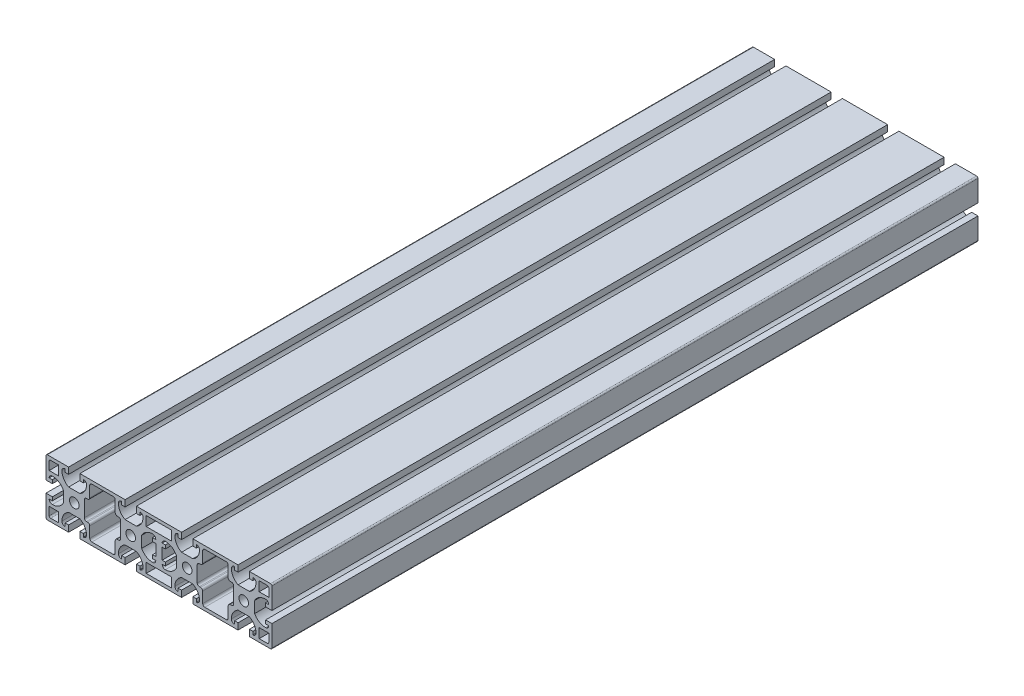
from build123d import *

# Parameters (mm, degrees)
SZKIC1_W                    = 18.057236458
SZKIC1_H                    = 6.778618229
SZKIC1_R                    = 3.4
DODANIE_WYCI_GNI_CIE1_DEPTH = 500


with BuildPart() as part:
    # Szkic1 → Dodanie-wyciągnięcie1 (new body)
    with BuildSketch(Plane.XY):
        with BuildLine():
            Line((-56, -20), (-24, -20))
            Line((-24, -20), (-24, -15.5))
            Line((-24, -15.5), (-26.471381771, -15.5))
            Line((-26.471381771, -15.5), (-26.471381771, -17.75))
            ThreePointArc((-26.471381771, -17.75), (-28.062372029, -17.090990258), (-28.721381771, -15.5))
            ThreePointArc((-28.721381771, -15.5), (-27.448087912, -10.962546258), (-24, -7.75))
            Line((-24, -7.75), (-16, -7.75))
            ThreePointArc((-16, -7.75), (-12.551912088, -10.962546258), (-11.278618229, -15.5))
            ThreePointArc((-11.278618229, -15.5), (-11.937627971, -17.090990258), (-13.528618229, -17.75))
            Line((-13.528618229, -17.75), (-13.528618229, -15.5))
            Line((-13.528618229, -15.5), (-16, -15.5))
            Line((-16, -15.5), (-16, -20))
            Line((-16, -20), (16, -20))
            Line((16, -20), (16, -15.5))
            Line((16, -15.5), (13.528618229, -15.5))
            Line((13.528618229, -15.5), (13.528618229, -17.75))
            ThreePointArc((13.528618229, -17.75), (11.937627971, -17.090990258), (11.278618229, -15.5))
            ThreePointArc((11.278618229, -15.5), (12.551912088, -10.962546258), (16, -7.75))
            Line((16, -7.75), (24, -7.75))
            ThreePointArc((24, -7.75), (27.448087912, -10.962546258), (28.721381771, -15.5))
            ThreePointArc((28.721381771, -15.5), (28.062372029, -17.090990258), (26.471381771, -17.75))
            Line((26.471381771, -17.75), (26.471381771, -15.5))
            Line((26.471381771, -15.5), (24, -15.5))
            Line((24, -15.5), (24, -20))
            Line((24, -20), (39, -20))
            ThreePointArc((39, -20), (39.707106781, -19.707106781), (40, -19))
            Line((40, -19), (40, -4))
            Line((40, -4), (35.5, -4))
            Line((35.5, -4), (35.5, -6.471381771))
            Line((35.5, -6.471381771), (37.75, -6.471381771))
            ThreePointArc((37.75, -6.471381771), (37.090990258, -8.062372029), (35.5, -8.721381771))
            ThreePointArc((35.5, -8.721381771), (30.962546258, -7.448087912), (27.75, -4))
            Line((27.75, -4), (27.75, 4))
            ThreePointArc((27.75, 4), (30.962546258, 7.448087912), (35.5, 8.721381771))
            ThreePointArc((35.5, 8.721381771), (37.090990258, 8.062372029), (37.75, 6.471381771))
            Line((37.75, 6.471381771), (35.5, 6.471381771))
            Line((35.5, 6.471381771), (35.5, 4))
            Line((35.5, 4), (40, 4))
            Line((40, 4), (40, 19))
            ThreePointArc((40, 19), (39.707106781, 19.707106781), (39, 20))
            Line((39, 20), (24, 20))
            Line((24, 20), (24, 15.5))
            Line((24, 15.5), (26.471381771, 15.5))
            Line((26.471381771, 15.5), (26.471381771, 17.75))
            ThreePointArc((26.471381771, 17.75), (28.062372029, 17.090990258), (28.721381771, 15.5))
            ThreePointArc((28.721381771, 15.5), (27.448087912, 10.962546258), (24, 7.75))
            Line((24, 7.75), (16, 7.75))
            ThreePointArc((16, 7.75), (12.551912088, 10.962546258), (11.278618229, 15.5))
            ThreePointArc((11.278618229, 15.5), (11.937627971, 17.090990258), (13.528618229, 17.75))
            Line((13.528618229, 17.75), (13.528618229, 15.5))
            Line((13.528618229, 15.5), (16, 15.5))
            Line((16, 15.5), (16, 20))
            Line((16, 20), (-16, 20))
            Line((-16, 20), (-16, 15.5))
            Line((-16, 15.5), (-13.528618229, 15.5))
            Line((-13.528618229, 15.5), (-13.528618229, 17.75))
            ThreePointArc((-13.528618229, 17.75), (-11.937627971, 17.090990258), (-11.278618229, 15.5))
            ThreePointArc((-11.278618229, 15.5), (-12.551912088, 10.962546258), (-16, 7.75))
            Line((-16, 7.75), (-24, 7.75))
            ThreePointArc((-24, 7.75), (-27.448087912, 10.962546258), (-28.721381771, 15.5))
            ThreePointArc((-28.721381771, 15.5), (-28.062372029, 17.090990258), (-26.471381771, 17.75))
            Line((-26.471381771, 17.75), (-26.471381771, 15.5))
            Line((-26.471381771, 15.5), (-24, 15.5))
            Line((-24, 15.5), (-24, 20))
            Line((-24, 20), (-56, 20))
            Line((-56, 20), (-56, 15.5))
            Line((-56, 15.5), (-53.528618229, 15.5))
            Line((-53.528618229, 15.5), (-53.528618229, 17.75))
            ThreePointArc((-53.528618229, 17.75), (-51.937627971, 17.090990258), (-51.278618229, 15.5))
            ThreePointArc((-51.278618229, 15.5), (-52.551912088, 10.962546258), (-56, 7.75))
            Line((-56, 7.75), (-64, 7.75))
            ThreePointArc((-64, 7.75), (-67.448087912, 10.962546258), (-68.721381771, 15.5))
            ThreePointArc((-68.721381771, 15.5), (-68.062372029, 17.090990258), (-66.471381771, 17.75))
            Line((-66.471381771, 17.75), (-66.471381771, 15.5))
            Line((-66.471381771, 15.5), (-64, 15.5))
            Line((-64, 15.5), (-64, 20))
            Line((-64, 20), (-96, 20))
            Line((-96, 20), (-96, 15.5))
            Line((-96, 15.5), (-93.528618229, 15.5))
            Line((-93.528618229, 15.5), (-93.528618229, 17.75))
            ThreePointArc((-93.528618229, 17.75), (-91.937627971, 17.090990258), (-91.278618229, 15.5))
            ThreePointArc((-91.278618229, 15.5), (-92.551912088, 10.962546258), (-96, 7.75))
            Line((-96, 7.75), (-104, 7.75))
            ThreePointArc((-104, 7.75), (-107.448087912, 10.962546258), (-108.721381771, 15.5))
            ThreePointArc((-108.721381771, 15.5), (-108.062372029, 17.090990258), (-106.471381771, 17.75))
            Line((-106.471381771, 17.75), (-106.471381771, 15.5))
            Line((-106.471381771, 15.5), (-104, 15.5))
            Line((-104, 15.5), (-104, 20))
            Line((-104, 20), (-119, 20))
            ThreePointArc((-119, 20), (-119.707106781, 19.707106781), (-120, 19))
            Line((-120, 19), (-120, 4))
            Line((-120, 4), (-115.5, 4))
            Line((-115.5, 4), (-115.5, 6.471381771))
            Line((-115.5, 6.471381771), (-117.75, 6.471381771))
            ThreePointArc((-117.75, 6.471381771), (-117.090990258, 8.062372029), (-115.5, 8.721381771))
            ThreePointArc((-115.5, 8.721381771), (-110.962546258, 7.448087912), (-107.75, 4))
            Line((-107.75, 4), (-107.75, -4))
            ThreePointArc((-107.75, -4), (-110.962546258, -7.448087912), (-115.5, -8.721381771))
            ThreePointArc((-115.5, -8.721381771), (-117.090990258, -8.062372029), (-117.75, -6.471381771))
            Line((-117.75, -6.471381771), (-115.5, -6.471381771))
            Line((-115.5, -6.471381771), (-115.5, -4))
            Line((-115.5, -4), (-120, -4))
            Line((-120, -4), (-120, -19))
            ThreePointArc((-120, -19), (-119.707106781, -19.707106781), (-119, -20))
            Line((-119, -20), (-104, -20))
            Line((-104, -20), (-104, -15.5))
            Line((-104, -15.5), (-106.471381771, -15.5))
            Line((-106.471381771, -15.5), (-106.471381771, -17.75))
            ThreePointArc((-106.471381771, -17.75), (-108.062372029, -17.090990258), (-108.721381771, -15.5))
            ThreePointArc((-108.721381771, -15.5), (-107.448087912, -10.962546258), (-104, -7.75))
            Line((-104, -7.75), (-96, -7.75))
            ThreePointArc((-96, -7.75), (-92.551912088, -10.962546258), (-91.278618229, -15.5))
            ThreePointArc((-91.278618229, -15.5), (-91.937627971, -17.090990258), (-93.528618229, -17.75))
            Line((-93.528618229, -17.75), (-93.528618229, -15.5))
            Line((-93.528618229, -15.5), (-96, -15.5))
            Line((-96, -15.5), (-96, -20))
            Line((-96, -20), (-64, -20))
            Line((-64, -20), (-64, -15.5))
            Line((-64, -15.5), (-66.471381771, -15.5))
            Line((-66.471381771, -15.5), (-66.471381771, -17.75))
            ThreePointArc((-66.471381771, -17.75), (-68.062372029, -17.090990258), (-68.721381771, -15.5))
            ThreePointArc((-68.721381771, -15.5), (-67.448087912, -10.962546258), (-64, -7.75))
            Line((-64, -7.75), (-56, -7.75))
            ThreePointArc((-56, -7.75), (-52.551912088, -10.962546258), (-51.278618229, -15.5))
            ThreePointArc((-51.278618229, -15.5), (-51.937627971, -17.090990258), (-53.528618229, -17.75))
            Line((-53.528618229, -17.75), (-53.528618229, -15.5))
            Line((-53.528618229, -15.5), (-56, -15.5))
            Line((-56, -15.5), (-56, -20))
        make_face()
        with Locations((-40, 14.360690886)):
            Rectangle(SZKIC1_W, SZKIC1_H, mode=Mode.SUBTRACT)
        with Locations((-40, -14.360690886)):
            Rectangle(SZKIC1_W, SZKIC1_H, mode=Mode.SUBTRACT)
        with BuildLine():
            Line((-117.75, -10.971381771), (-110.971381771, -10.971381771))
            Line((-110.971381771, -10.971381771), (-110.971381771, -17.75))
            Line((-110.971381771, -17.75), (-116.75, -17.75))
            ThreePointArc((-116.75, -17.75), (-117.457106781, -17.457106781), (-117.75, -16.75))
            Line((-117.75, -16.75), (-117.75, -10.971381771))
        make_face(mode=Mode.SUBTRACT)
        with BuildLine():
            ThreePointArc((-89.028618229, -8.590188806), (-89.467958057, -7.529528634), (-90.528618229, -7.090188806))
            Line((-90.528618229, -7.090188806), (-91.40950808, -7.090188806))
            ThreePointArc((-91.40950808, -7.090188806), (-92.470168251, -6.650848977), (-92.90950808, -5.590188806))
            Line((-92.90950808, -5.590188806), (-92.90950808, 5.590188806))
            ThreePointArc((-92.90950808, 5.590188806), (-92.470168251, 6.650848977), (-91.40950808, 7.090188806))
            Line((-91.40950808, 7.090188806), (-90.528618229, 7.090188806))
            ThreePointArc((-90.528618229, 7.090188806), (-89.467958057, 7.529528634), (-89.028618229, 8.590188806))
            Line((-89.028618229, 8.590188806), (-89.028618229, 16.25))
            ThreePointArc((-89.028618229, 16.25), (-88.589278401, 17.310660172), (-87.528618229, 17.75))
            Line((-87.528618229, 17.75), (-72.471381771, 17.75))
            ThreePointArc((-72.471381771, 17.75), (-71.410721599, 17.310660172), (-70.971381771, 16.25))
            Line((-70.971381771, 16.25), (-70.971381771, 8.590188806))
            ThreePointArc((-70.971381771, 8.590188806), (-70.532041943, 7.529528634), (-69.471381771, 7.090188806))
            Line((-69.471381771, 7.090188806), (-68.59049192, 7.090188806))
            ThreePointArc((-68.59049192, 7.090188806), (-67.529831749, 6.650848977), (-67.09049192, 5.590188806))
            Line((-67.09049192, 5.590188806), (-67.09049192, -5.590188806))
            ThreePointArc((-67.09049192, -5.590188806), (-67.529831749, -6.650848977), (-68.59049192, -7.090188806))
            Line((-68.59049192, -7.090188806), (-69.471381771, -7.090188806))
            ThreePointArc((-69.471381771, -7.090188806), (-70.532041943, -7.529528634), (-70.971381771, -8.590188806))
            Line((-70.971381771, -8.590188806), (-70.971381771, -16.25))
            ThreePointArc((-70.971381771, -16.25), (-71.410721599, -17.310660172), (-72.471381771, -17.75))
            Line((-72.471381771, -17.75), (-87.528618229, -17.75))
            ThreePointArc((-87.528618229, -17.75), (-88.589278401, -17.310660172), (-89.028618229, -16.25))
            Line((-89.028618229, -16.25), (-89.028618229, -8.590188806))
        make_face(mode=Mode.SUBTRACT)
        with BuildLine():
            Line((-44.5, 4), (-42.25, 4))
            Line((-42.25, 4), (-42.25, -4))
            Line((-42.25, -4), (-44.5, -4))
            Line((-44.5, -4), (-44.5, -6.471381771))
            Line((-44.5, -6.471381771), (-42.25, -6.471381771))
            ThreePointArc((-42.25, -6.471381771), (-42.909009742, -8.062372029), (-44.5, -8.721381771))
            ThreePointArc((-44.5, -8.721381771), (-49.037453742, -7.448087912), (-52.25, -4))
            Line((-52.25, -4), (-52.25, 4))
            ThreePointArc((-52.25, 4), (-49.037453742, 7.448087912), (-44.5, 8.721381771))
            ThreePointArc((-44.5, 8.721381771), (-42.909009742, 8.062372029), (-42.25, 6.471381771))
            Line((-42.25, 6.471381771), (-44.5, 6.471381771))
            Line((-44.5, 6.471381771), (-44.5, 4))
        make_face(mode=Mode.SUBTRACT)
        with Locations((-100, 0)):
            Circle(SZKIC1_R, mode=Mode.SUBTRACT)
        with Locations((-60, 0)):
            Circle(SZKIC1_R, mode=Mode.SUBTRACT)
        with BuildLine():
            Line((-110.971381771, 10.971381771), (-117.75, 10.971381771))
            Line((-117.75, 10.971381771), (-117.75, 16.75))
            ThreePointArc((-117.75, 16.75), (-117.457106781, 17.457106781), (-116.75, 17.75))
            Line((-116.75, 17.75), (-110.971381771, 17.75))
            Line((-110.971381771, 17.75), (-110.971381771, 10.971381771))
        make_face(mode=Mode.SUBTRACT)
        with BuildLine():
            ThreePointArc((36.75, 17.75), (37.457106781, 17.457106781), (37.75, 16.75))
            Line((37.75, 16.75), (37.75, 10.971381771))
            Line((37.75, 10.971381771), (30.971381771, 10.971381771))
            Line((30.971381771, 10.971381771), (30.971381771, 17.75))
            Line((30.971381771, 17.75), (36.75, 17.75))
        make_face(mode=Mode.SUBTRACT)
        with BuildLine():
            Line((36.75, -17.75), (30.971381771, -17.75))
            Line((30.971381771, -17.75), (30.971381771, -10.971381771))
            Line((30.971381771, -10.971381771), (37.75, -10.971381771))
            Line((37.75, -10.971381771), (37.75, -16.75))
            ThreePointArc((37.75, -16.75), (37.457106781, -17.457106781), (36.75, -17.75))
        make_face(mode=Mode.SUBTRACT)
        with BuildLine():
            Line((-37.75, -6.471381771), (-35.5, -6.471381771))
            Line((-35.5, -6.471381771), (-35.5, -4))
            Line((-35.5, -4), (-37.75, -4))
            Line((-37.75, -4), (-37.75, 4))
            Line((-37.75, 4), (-35.5, 4))
            Line((-35.5, 4), (-35.5, 6.471381771))
            Line((-35.5, 6.471381771), (-37.75, 6.471381771))
            ThreePointArc((-37.75, 6.471381771), (-37.090990258, 8.062372029), (-35.5, 8.721381771))
            ThreePointArc((-35.5, 8.721381771), (-30.962546258, 7.448087912), (-27.75, 4))
            Line((-27.75, 4), (-27.75, -4))
            ThreePointArc((-27.75, -4), (-30.962546258, -7.448087912), (-35.5, -8.721381771))
            ThreePointArc((-35.5, -8.721381771), (-37.090990258, -8.062372029), (-37.75, -6.471381771))
        make_face(mode=Mode.SUBTRACT)
        with BuildLine():
            ThreePointArc((9.028618229, 8.590188806), (9.467958057, 7.529528634), (10.528618229, 7.090188806))
            Line((10.528618229, 7.090188806), (11.40950808, 7.090188806))
            ThreePointArc((11.40950808, 7.090188806), (12.470168251, 6.650848977), (12.90950808, 5.590188806))
            Line((12.90950808, 5.590188806), (12.90950808, -5.590188806))
            ThreePointArc((12.90950808, -5.590188806), (12.470168251, -6.650848977), (11.40950808, -7.090188806))
            Line((11.40950808, -7.090188806), (10.528618229, -7.090188806))
            ThreePointArc((10.528618229, -7.090188806), (9.467958057, -7.529528634), (9.028618229, -8.590188806))
            Line((9.028618229, -8.590188806), (9.028618229, -16.25))
            ThreePointArc((9.028618229, -16.25), (8.589278401, -17.310660172), (7.528618229, -17.75))
            Line((7.528618229, -17.75), (-7.528618229, -17.75))
            ThreePointArc((-7.528618229, -17.75), (-8.589278401, -17.310660172), (-9.028618229, -16.25))
            Line((-9.028618229, -16.25), (-9.028618229, -8.590188806))
            ThreePointArc((-9.028618229, -8.590188806), (-9.467958057, -7.529528634), (-10.528618229, -7.090188806))
            Line((-10.528618229, -7.090188806), (-11.40950808, -7.090188806))
            ThreePointArc((-11.40950808, -7.090188806), (-12.470168251, -6.650848977), (-12.90950808, -5.590188806))
            Line((-12.90950808, -5.590188806), (-12.90950808, 5.590188806))
            ThreePointArc((-12.90950808, 5.590188806), (-12.470168251, 6.650848977), (-11.40950808, 7.090188806))
            Line((-11.40950808, 7.090188806), (-10.528618229, 7.090188806))
            ThreePointArc((-10.528618229, 7.090188806), (-9.467958057, 7.529528634), (-9.028618229, 8.590188806))
            Line((-9.028618229, 8.590188806), (-9.028618229, 16.25))
            ThreePointArc((-9.028618229, 16.25), (-8.589278401, 17.310660172), (-7.528618229, 17.75))
            Line((-7.528618229, 17.75), (7.528618229, 17.75))
            ThreePointArc((7.528618229, 17.75), (8.589278401, 17.310660172), (9.028618229, 16.25))
            Line((9.028618229, 16.25), (9.028618229, 8.590188806))
        make_face(mode=Mode.SUBTRACT)
        with Locations((-20, 0)):
            Circle(SZKIC1_R, mode=Mode.SUBTRACT)
        with Locations((20, 0)):
            Circle(SZKIC1_R, mode=Mode.SUBTRACT)
    extrude(amount=DODANIE_WYCI_GNI_CIE1_DEPTH)


solid = part.part
